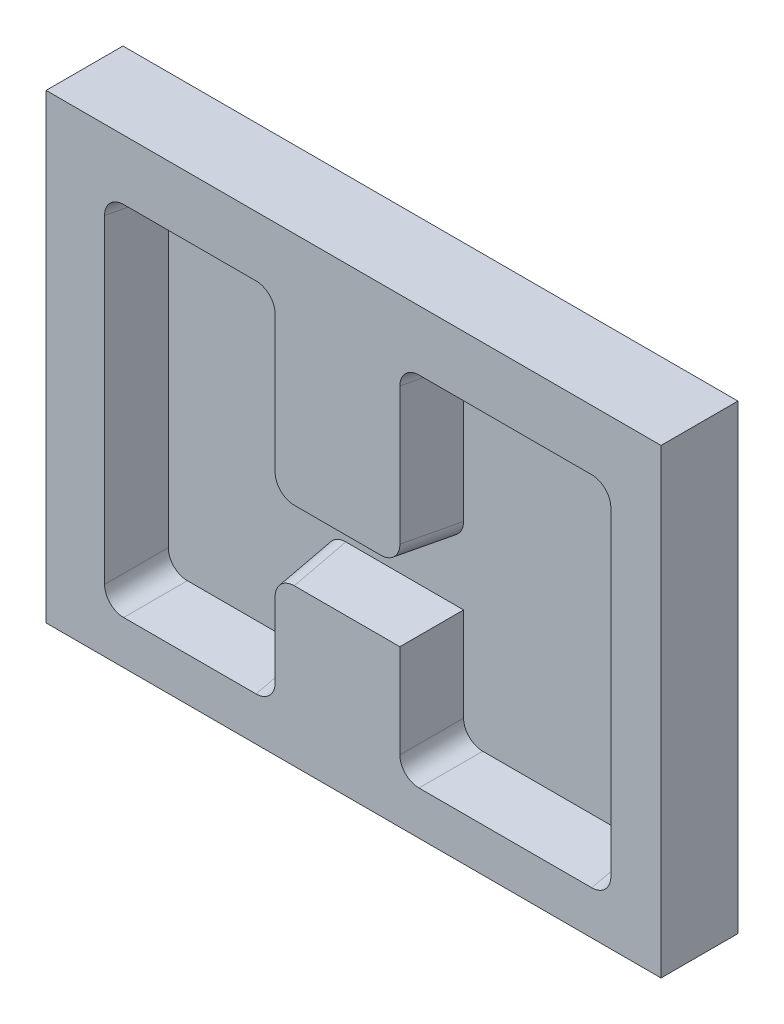
from build123d import *

# Parameters (mm, degrees)
SKETCH1_W          = 203.2
SKETCH1_H          = 152.4
EXTRUDE1_DEPTH     = 25.4
CUT_EXTRUDE1_DEPTH = 19.05
CUT_EXTRUDE1_DRAFT = -6
FILLET1_R          = 6.35


with BuildPart() as part:
    # Sketch1 → Extrude1 (new body)
    with BuildSketch(Plane.XY):
        with Locations((101.6, 76.2)):
            Rectangle(SKETCH1_W, SKETCH1_H)
    extrude(amount=EXTRUDE1_DEPTH)


with BuildPart() as cut_extrude1_tool:
    # Sketch2 → Cut-Extrude1 (with draft: the straight prism first)
    with BuildSketch(Plane.XY.offset(25.4)):
        Polygon((19.319910515, 132.568680089), (19.319910515, 14.376286353), (75.688590604, 14.376286353), (75.688590604, 51.652348993), (116.904399702, 51.652348993), (116.904399702, 14.376286353), (186.607606264, 14.376286353), (186.607606264, 132.568680089), (116.904399702, 132.568680089), (116.904399702, 74.684712901), (75.688590604, 74.684712901), (75.688590604, 132.568680089), align=None)
    extrude(amount=-CUT_EXTRUDE1_DEPTH)
    # Cut-Extrude1: the draft: its side faces are tilted about the plane it starts from
    cut_extrude1_sides = [cut_extrude1_tool.faces().sort_by_distance(p)[0] for p in [
        (19.319910515, 73.472483221, 15.875),
        (47.504250559, 14.376286353, 15.875),
        (75.688590604, 33.014317673, 15.875),
        (96.296495153, 51.652348993, 15.875),
        (116.904399702, 33.014317673, 15.875),
        (151.756002983, 14.376286353, 15.875),
        (186.607606264, 73.472483221, 15.875),
        (151.756002983, 132.568680089, 15.875),
        (116.904399702, 103.626696495, 15.875),
        (96.296495153, 74.684712901, 15.875),
        (75.688590604, 103.626696495, 15.875),
        (47.504250559, 132.568680089, 15.875),
    ]]
    draft(cut_extrude1_sides, Plane.XY.offset(25.4), CUT_EXTRUDE1_DRAFT)


with BuildPart() as part_1:
    add(part.part)

    # Cut-Extrude1: cut by cut_extrude1_tool
    add(cut_extrude1_tool.part, mode=Mode.SUBTRACT)

    # Fillet1
    fillet1_edges = [part_1.edges().sort_by_distance(p)[0] for p in [
        (20.321028355, 131.567562249, 15.875),
        (20.321028355, 15.377404194, 15.875),
        (74.687472763, 15.377404194, 15.875),
        (74.687472763, 52.653466834, 15.875),
        (117.905517543, 15.377404194, 15.875),
        (185.606488423, 15.377404194, 15.875),
        (185.606488423, 131.567562249, 15.875),
        (117.905517543, 131.567562249, 15.875),
        (117.905517543, 73.68359506, 15.875),
        (74.687472763, 73.68359506, 15.875),
        (74.687472763, 131.567562249, 15.875),
    ]]
    fillet(fillet1_edges, radius=FILLET1_R)


solid = part_1.part
